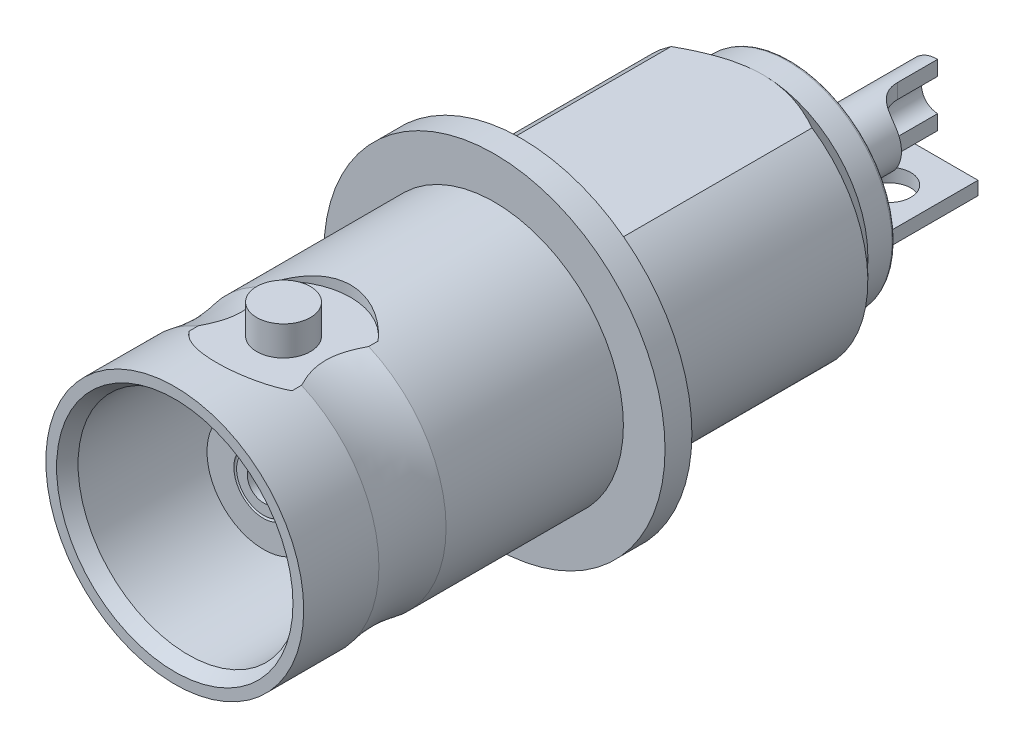
from build123d import *

# Parameters (mm, degrees)
CUT_EXTRUDE_START        = 4.4
SKETCH_3_R               = 2.5
CUT_EXTRUDE_2_DEPTH      = 21.197865761
CUT_EXTRUDE_START_2      = -4.4
SKETCH_3_2_R             = 2.5
CUT_EXTRUDE_3_DEPTH      = 21.197865761
EXTRUDE_START            = 4.4
SKETCH_5_R               = 1
EXTRUDE_4_DEPTH          = 1.1
EXTRUDE_START_2          = -5.5
SKETCH_5_2_R             = 1
EXTRUDE_5_DEPTH          = 1.1
CUT_EXTRUDE_6_DEPTH      = 10
SKETCH_7_R               = 1.15
SKETCH_7_R_2             = 0.6
SKETCH_7_W               = 3
SKETCH_7_H               = 0.5
EXTRUDE_8_DEPTH          = 5.5
CUT_EXTRUDE_9_DEPTH      = 1.5
CUT_EXTRUDE_9_DEPTH_BACK = 1.5
SKETCH_9_R               = 0.8
CUT_EXTRUDE_10_DEPTH     = 1


with BuildPart() as part:
    # Эскиз1 → Повернуть1 (revolve)
    with BuildSketch(Plane(origin=(0, 0, 0), x_dir=(0, 0, -1), z_dir=(1, 0, 0)), mode=Mode.PRIVATE) as revolve_1_sk:
        with BuildLine():
            Line((10.3, 0), (10.3, 0.6))
            Line((10.3, 0.6), (3.3, 0.6))
            Line((3.3, 0.6), (3.3, 1))
            ThreePointArc((3.3, 1), (3.35, 1.05), (3.3, 1.1))
            Line((3.3, 1.1), (3.3, 2.1))
            Line((3.3, 2.1), (8.4, 2.1))
            Line((8.4, 2.1), (8.4, 4.1))
            Line((8.4, 4.1), (0.5, 4.1))
            Line((0.5, 4.1), (0, 4.4))
            Line((0, 4.4), (0, 4.8))
            Line((0, 4.8), (2.8, 4.8))
            ThreePointArc((2.8, 4.8), (4.05, 4.668347297), (5.3, 4.8))
            Line((5.3, 4.8), (11.9, 4.8))
            Line((11.9, 4.8), (11.9, 6.35))
            Line((11.9, 6.35), (12.9, 6.35))
            Line((12.9, 6.35), (12.9, 4.7))
            Line((12.9, 4.7), (21.1, 4.7))
            Line((21.1, 4.7), (21.9, 3.9))
            Line((21.9, 3.9), (22.8, 3.9))
            ThreePointArc((22.8, 3.9), (22.870710678, 3.870710678), (22.9, 3.8))
            Line((22.9, 3.8), (22.9, 0))
            Line((22.9, 0), (10.3, 0))
        make_face()
    revolve(revolve_1_sk.sketch.rotate(Axis((0, 0, 0), (0, 0, -1)), 90), axis=Axis((0, 0, 0), (0, 0, -1)))

    # Эскиз3 → Вытянуть2 (cut, through all)
    with BuildSketch(Plane(origin=(0, 0, 0), x_dir=(1, 0, 0), z_dir=(0, 1, 0)).offset(CUT_EXTRUDE_START)):
        with Locations((0, 4.05)):
            Circle(SKETCH_3_R)
    extrude(amount=CUT_EXTRUDE_2_DEPTH, mode=Mode.SUBTRACT)

    # Эскиз3<2> → Вытянуть3 (cut, through all)
    with BuildSketch(Plane(origin=(0, 0, 0), x_dir=(1, 0, 0), z_dir=(0, 1, 0)).offset(CUT_EXTRUDE_START_2)):
        with Locations((0, 4.05)):
            Circle(SKETCH_3_2_R)
    extrude(amount=-CUT_EXTRUDE_3_DEPTH, mode=Mode.SUBTRACT)

    # Эскиз5 → Вытянуть4 (add)
    with BuildSketch(Plane(origin=(0, 0, 0), x_dir=(1, 0, 0), z_dir=(0, 1, 0)).offset(EXTRUDE_START)):
        with Locations(Location((0, 4.05, 0), (0, 0, 270))):
            Circle(SKETCH_5_R)
    extrude(amount=EXTRUDE_4_DEPTH)

    # Эскиз5<2> → Вытянуть5 (add)
    with BuildSketch(Plane(origin=(0, 0, 0), x_dir=(1, 0, 0), z_dir=(0, 1, 0)).offset(EXTRUDE_START_2)):
        with Locations(Location((0, 4.05, 0), (0, 0, 270))):
            Circle(SKETCH_5_2_R)
    extrude(amount=EXTRUDE_5_DEPTH)

    # Эскиз2 → Вытянуть6 (cut)
    with BuildSketch(Plane(origin=(0, 0, -22.9), x_dir=(-1, 0, 0), z_dir=(0, 0, -1))):
        with BuildLine():
            Line((-2.62297541, 3.9), (2.62297541, 3.9))
            ThreePointArc((2.62297541, 3.9), (0, 4.7), (-2.62297541, 3.9))
        make_face()
    extrude(amount=-CUT_EXTRUDE_6_DEPTH, mode=Mode.SUBTRACT)

    # Эскиз7 → Вытянуть8 (add)
    # profile 1 of 2: a face of its own
    with BuildSketch(Plane(origin=(0, 0, -22.9), x_dir=(-1, 0, 0), z_dir=(0, 0, -1))):
        with Locations(Location((0, 0, 0), (0, 0, 180))):
            Circle(SKETCH_7_R)
        with Locations(Location((0, 0, 0), (0, 0, 180))):
            Circle(SKETCH_7_R_2, mode=Mode.SUBTRACT)
    # profile 2 of 2: a face of its own
    with BuildSketch(Plane(origin=(0, 0, -22.9), x_dir=(-1, 0, 0), z_dir=(0, 0, -1))):
        with Locations((0, -2.25)):
            Rectangle(SKETCH_7_W, SKETCH_7_H)
    extrude(amount=EXTRUDE_8_DEPTH)

    # Эскиз8 → Вытянуть9 (cut, two sides: drawn at the far end of the back side and taken through both)
    with BuildSketch(Plane(origin=(0, 0, 0), x_dir=(1, 0, 0), z_dir=(0, 1, 0)).offset(-CUT_EXTRUDE_9_DEPTH_BACK)):
        with BuildLine():
            Line((0, 30.676927372), (3.471261933, 30.676927372))
            Line((3.471261933, 30.676927372), (3.471261933, 25.9))
            Line((3.471261933, 25.9), (1, 25.9))
            ThreePointArc((1, 25.9), (0.292893219, 26.192893219), (0, 26.9))
            Line((0, 26.9), (0, 30.676927372))
        make_face()
    extrude(amount=CUT_EXTRUDE_9_DEPTH + CUT_EXTRUDE_9_DEPTH_BACK, mode=Mode.SUBTRACT)

    # Эскиз9 → Вытянуть10 (cut)
    with BuildSketch(Plane.XZ.offset(2.5)):
        with Locations((0, -26.6)):
            Circle(SKETCH_9_R)
    extrude(amount=-CUT_EXTRUDE_10_DEPTH, mode=Mode.SUBTRACT)


solid = part.part
